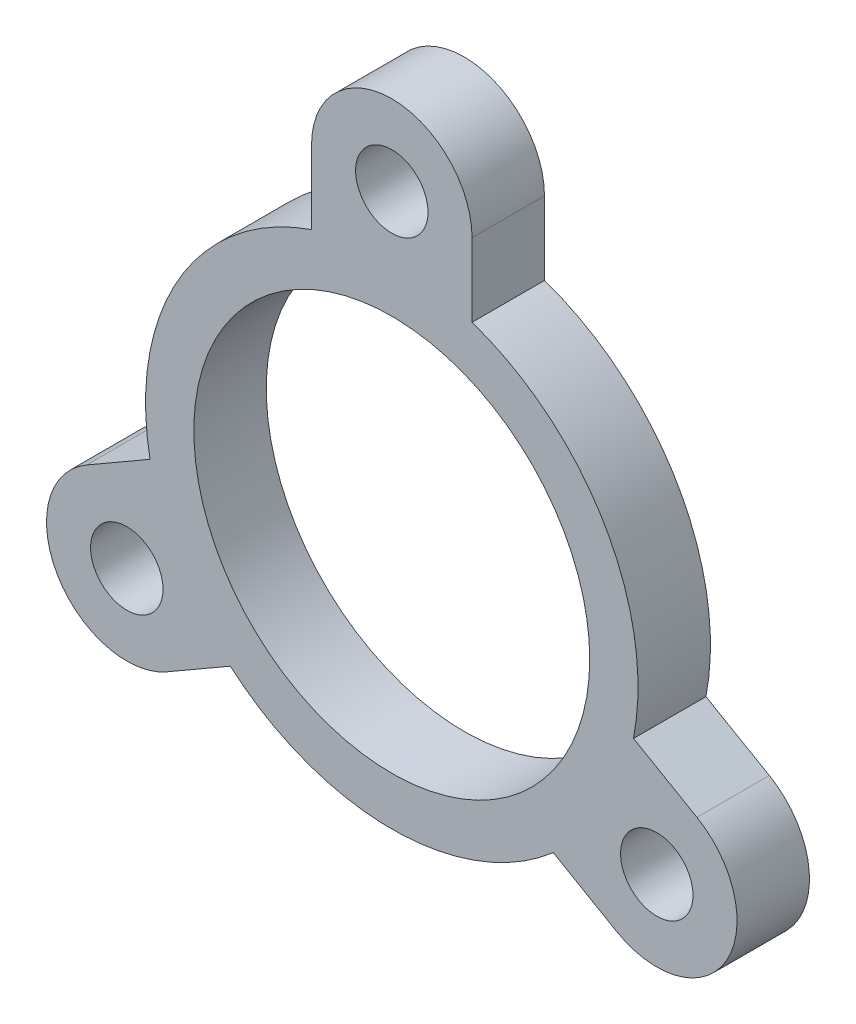
from build123d import *

# Parameters (mm, degrees)
SKETCH_1_R      = 1.5
EXTRUDE_1_DEPTH = 1.5


with BuildPart() as part:
    # Эскиз1 → Бобышка-Вытянуть1 (new, symmetric)
    # profile 1 of 9: a face of its own
    with BuildSketch(Plane.XY):
        with BuildLine():
            Line((-3.325, 7.495623723), (-3.325, 9.642840608))
            ThreePointArc((-3.325, 9.642840608), (-8.833459119, 5.1), (-10.013444932, -1.941885837))
            Line((-10.013444932, -1.941885837), (-8.153900562, -0.868277394))
            ThreePointArc((-8.153900562, -0.868277394), (-7.101408311, 4.1), (-3.325, 7.495623723))
        make_face()
    # profile 2 of 9: a face of its own
    with BuildSketch(Plane.XY):
        with BuildLine():
            Line((-8.153900562, -0.868277394), (-10.013444932, -1.941885837))
            ThreePointArc((-10.013444932, -1.941885837), (-8.833459119, -5.1), (-6.688444932, -7.700954772))
            Line((-6.688444932, -7.700954772), (-4.828900562, -6.627346329))
            ThreePointArc((-4.828900562, -6.627346329), (-7.101408311, -4.1), (-8.153900562, -0.868277394))
        make_face()
    # profile 3 of 9: a face of its own
    with BuildSketch(Plane.XY):
        with BuildLine():
            ThreePointArc((-6.688444932, -7.700954772), (-8.833459119, -5.1), (-10.013444932, -1.941885837))
            Line((-10.013444932, -1.941885837), (-12.639371993, -3.457965532))
            ThreePointArc((-12.639371993, -3.457965532), (-13.856406461, -8), (-9.314371993, -9.217034468))
            Line((-9.314371993, -9.217034468), (-6.688444932, -7.700954772))
        make_face()
        with Locations((-10.976871993, -6.3375)):
            Circle(SKETCH_1_R, mode=Mode.SUBTRACT)
    # profile 4 of 9: a face of its own
    with BuildSketch(Plane.XY):
        with BuildLine():
            ThreePointArc((-6.688444932, -7.700954772), (0, -10.2), (6.688444932, -7.700954772))
            Line((6.688444932, -7.700954772), (4.828900562, -6.627346329))
            ThreePointArc((4.828900562, -6.627346329), (0, -8.2), (-4.828900562, -6.627346329))
            Line((-4.828900562, -6.627346329), (-6.688444932, -7.700954772))
        make_face()
    # profile 5 of 9: a face of its own
    with BuildSketch(Plane.XY):
        with BuildLine():
            ThreePointArc((6.688444932, -7.700954772), (8.833459119, -5.1), (10.013444932, -1.941885837))
            Line((10.013444932, -1.941885837), (8.153900562, -0.868277394))
            ThreePointArc((8.153900562, -0.868277394), (7.101408311, -4.1), (4.828900562, -6.627346329))
            Line((4.828900562, -6.627346329), (6.688444932, -7.700954772))
        make_face()
    # profile 6 of 9: a face of its own
    with BuildSketch(Plane.XY):
        with BuildLine():
            Line((12.639371993, -3.457965532), (10.013444932, -1.941885837))
            ThreePointArc((10.013444932, -1.941885837), (8.833459119, -5.1), (6.688444932, -7.700954772))
            Line((6.688444932, -7.700954772), (9.314371993, -9.217034468))
            ThreePointArc((9.314371993, -9.217034468), (13.856406461, -8), (12.639371993, -3.457965532))
        make_face()
        with Locations((10.976871993, -6.3375)):
            Circle(SKETCH_1_R, mode=Mode.SUBTRACT)
    # profile 7 of 9: a face of its own
    with BuildSketch(Plane.XY):
        with BuildLine():
            ThreePointArc((10.2, 0), (8.305269412, 5.921359641), (3.325, 9.642840608))
            Line((3.325, 9.642840608), (3.325, 7.495623723))
            ThreePointArc((3.325, 7.495623723), (6.874045388, 4.470738194), (8.2, 0))
            ThreePointArc((8.2, 0), (8.18846703, -0.434750156), (8.153900562, -0.868277394))
            Line((8.153900562, -0.868277394), (10.013444932, -1.941885837))
            ThreePointArc((10.013444932, -1.941885837), (10.153254116, -0.975413168), (10.2, 0))
        make_face()
    # profile 8 of 9: a face of its own
    with BuildSketch(Plane.XY):
        with BuildLine():
            Line((3.325, 7.495623723), (3.325, 9.642840608))
            ThreePointArc((3.325, 9.642840608), (0, 10.2), (-3.325, 9.642840608))
            Line((-3.325, 9.642840608), (-3.325, 7.495623723))
            ThreePointArc((-3.325, 7.495623723), (0, 8.2), (3.325, 7.495623723))
        make_face()
    # profile 9 of 9: a face of its own
    with BuildSketch(Plane.XY):
        with BuildLine():
            Line((3.325, 9.642840608), (3.325, 12.675))
            ThreePointArc((3.325, 12.675), (0, 16), (-3.325, 12.675))
            Line((-3.325, 12.675), (-3.325, 9.642840608))
            ThreePointArc((-3.325, 9.642840608), (0, 10.2), (3.325, 9.642840608))
        make_face()
        with Locations((0, 12.675)):
            Circle(SKETCH_1_R, mode=Mode.SUBTRACT)
    extrude(amount=EXTRUDE_1_DEPTH, both=True)


solid = part.part
